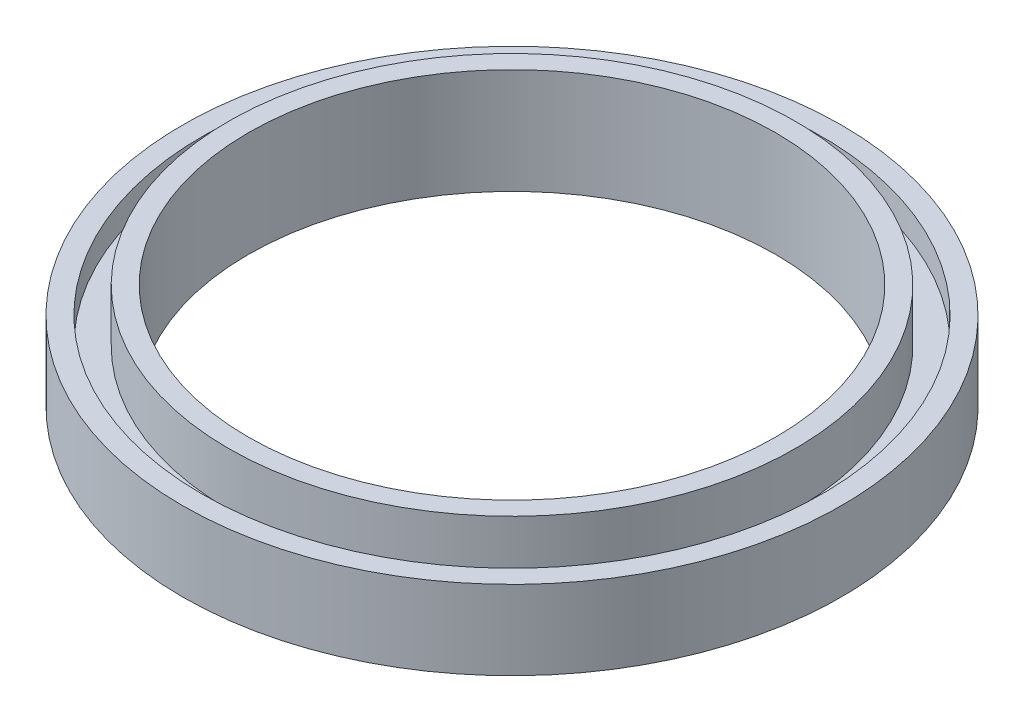
from build123d import *

# Parameters (mm, degrees)
SKETCH1_R           = 25
BOSS_EXTRUDE1_DEPTH = 8
SKETCH2_R           = 23.5
SKETCH2_R_2         = 21.5
CUT_EXTRUDE1_DEPTH  = 4
SKETCH3_R           = 25
SKETCH3_R_2         = 23.5
CUT_EXTRUDE2_DEPTH  = 2
CUT_EXTRUDE3_REACH  = 38.249
SKETCH4_R           = 20


with BuildPart() as part:
    # Sketch1 → Boss-Extrude1 (new body)
    with BuildSketch(Plane(origin=(0, 0, 0), x_dir=(1, 0, 0), z_dir=(0, 1, 0))):
        with Locations(Location((0, 0, 0), (0, 0, 270))):
            Circle(SKETCH1_R)
    extrude(amount=BOSS_EXTRUDE1_DEPTH)

    # Sketch2 → Cut-Extrude1 (cut)
    with BuildSketch(Plane(origin=(0, 8, 0), x_dir=(1, 0, 0), z_dir=(0, 1, 0))):
        with Locations(Location((0, 0, 0), (0, 0, 270))):
            Circle(SKETCH2_R)
        with Locations(Location((0, 0, 0), (0, 0, 270))):
            Circle(SKETCH2_R_2, mode=Mode.SUBTRACT)
    extrude(amount=-CUT_EXTRUDE1_DEPTH, mode=Mode.SUBTRACT)

    # Sketch3 → Cut-Extrude2 (cut)
    with BuildSketch(Plane(origin=(0, 8, 0), x_dir=(1, 0, 0), z_dir=(0, 1, 0))):
        with Locations(Location((0, 0, 0), (0, 0, 270))):
            Circle(SKETCH3_R)
        with Locations(Location((0, 0, 0), (0, 0, 270))):
            Circle(SKETCH3_R_2, mode=Mode.SUBTRACT)
    extrude(amount=-CUT_EXTRUDE2_DEPTH, mode=Mode.SUBTRACT)

    # Sketch4 → Cut-Extrude3 (cut, up to next)
    with BuildSketch(Plane(origin=(0, 8, 0), x_dir=(1, 0, 0), z_dir=(0, 1, 0)), mode=Mode.PRIVATE) as cut_extrude3_sk1:
        with Locations(Location((0, 0, 0), (0, 0, 270))):
            Circle(SKETCH4_R)
    cut_extrude3_tool1 = extrude(cut_extrude3_sk1.sketch, amount=-CUT_EXTRUDE3_REACH, mode=Mode.PRIVATE) & part.part
    add(cut_extrude3_tool1.solids().sort_by_distance((0, 8, 0))[0], mode=Mode.SUBTRACT)


solid = part.part
